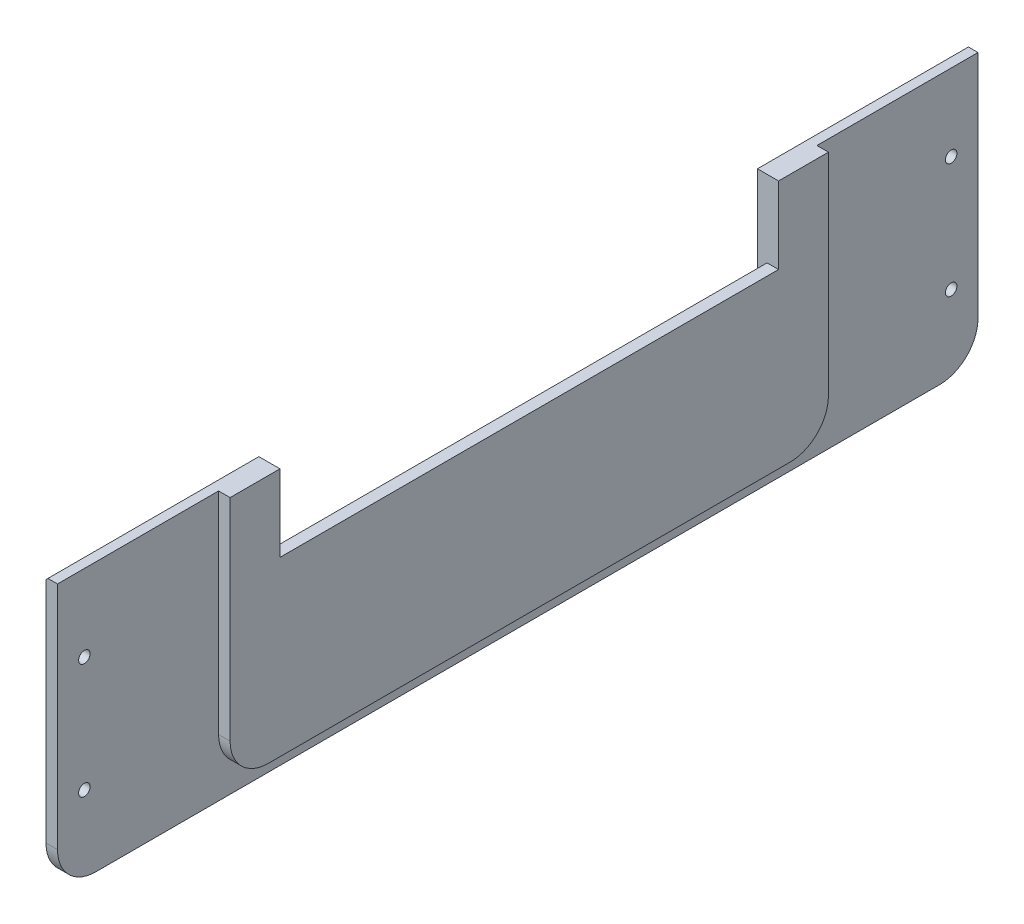
from build123d import *

# Parameters (mm, degrees)
SKETCH_1_W          = 240
SKETCH_1_H          = 70
EXTRUDE_1_DEPTH     = 3
SKETCH_4_W          = 156
SKETCH_4_H          = 65
EXTRUDE_3_DEPTH     = 3
SKETCH_5_R          = 1.5
CUT_EXTRUDE_1_DEPTH = 20
FILLET_1_R          = 10
FILLET_2_R          = 10
SKETCH_7_W          = 130
SKETCH_7_H          = 35
CUT_EXTRUDE_2_DEPTH = 3
SKETCH_8_W          = 130
SKETCH_8_H          = 20
CUT_EXTRUDE_3_DEPTH = 3
CHAMFER_1_SIZE      = 0.5
CHAMFER_2_SIZE      = 0.5


with BuildPart() as part:
    # 草图1 → 凸台-拉伸1 (new body)
    with BuildSketch(Plane(origin=(0, 0, 0), x_dir=(0, 0, -1), z_dir=(1, 0, 0))):
        with Locations((0, 10)):
            Rectangle(SKETCH_1_W, SKETCH_1_H)
    extrude(amount=EXTRUDE_1_DEPTH)

    # 草图4 → 凸台-拉伸3 (add)
    with BuildSketch(Plane(origin=(3, 0, 0), x_dir=(0, 0, -1), z_dir=(1, 0, 0))):
        with Locations((0, 12.5)):
            Rectangle(SKETCH_4_W, SKETCH_4_H)
    extrude(amount=EXTRUDE_3_DEPTH)

    # 草图5 → 切除-拉伸1 (cut)
    with BuildSketch(Plane.ZY):
        with Locations((113, 25)):
            Circle(SKETCH_5_R)
        with Locations((113, -5)):
            Circle(SKETCH_5_R)
        with Locations(Location((-113, -5, 0), (0, 0, 180))):
            Circle(SKETCH_5_R)
        with Locations(Location((-113, 25, 0), (0, 0, 180))):
            Circle(SKETCH_5_R)
    extrude(amount=-CUT_EXTRUDE_1_DEPTH, mode=Mode.SUBTRACT)

    # 圆角1
    fillet_1_edges = [part.edges().sort_by_distance(p)[0] for p in [
        (1.5, -25, -120),
        (1.5, -25, 120),
    ]]
    fillet(fillet_1_edges, radius=FILLET_1_R)

    # 圆角2
    fillet_2_edges = [part.edges().sort_by_distance(p)[0] for p in [
        (4.5, -20, 78),
        (4.5, -20, -78),
    ]]
    fillet(fillet_2_edges, radius=FILLET_2_R)

    # 草图7 → 切除-拉伸2 (cut)
    with BuildSketch(Plane.ZY):
        with Locations((0, 27.5)):
            Rectangle(SKETCH_7_W, SKETCH_7_H)
    extrude(amount=-CUT_EXTRUDE_2_DEPTH, mode=Mode.SUBTRACT)

    # 草图8 → 切除-拉伸3 (cut)
    with BuildSketch(Plane.ZY.offset(-3)):
        with Locations((0, 35)):
            Rectangle(SKETCH_8_W, SKETCH_8_H)
    extrude(amount=-CUT_EXTRUDE_3_DEPTH, mode=Mode.SUBTRACT)

    # 倒角1
    chamfer_1_edges = [part.edges().sort_by_distance(p)[0] for p in [
        (0, 45, -92.5),
        (0, 45, 92.5),
    ]]
    chamfer(chamfer_1_edges, length=CHAMFER_1_SIZE)

    # 倒角2
    chamfer_2_edges = [part.edges().sort_by_distance(p)[0] for p in [
        (0, 27.25, 65),
        (0, 10, 0),
        (0, 27.25, -65),
    ]]
    chamfer(chamfer_2_edges, length=CHAMFER_2_SIZE)


solid = part.part
